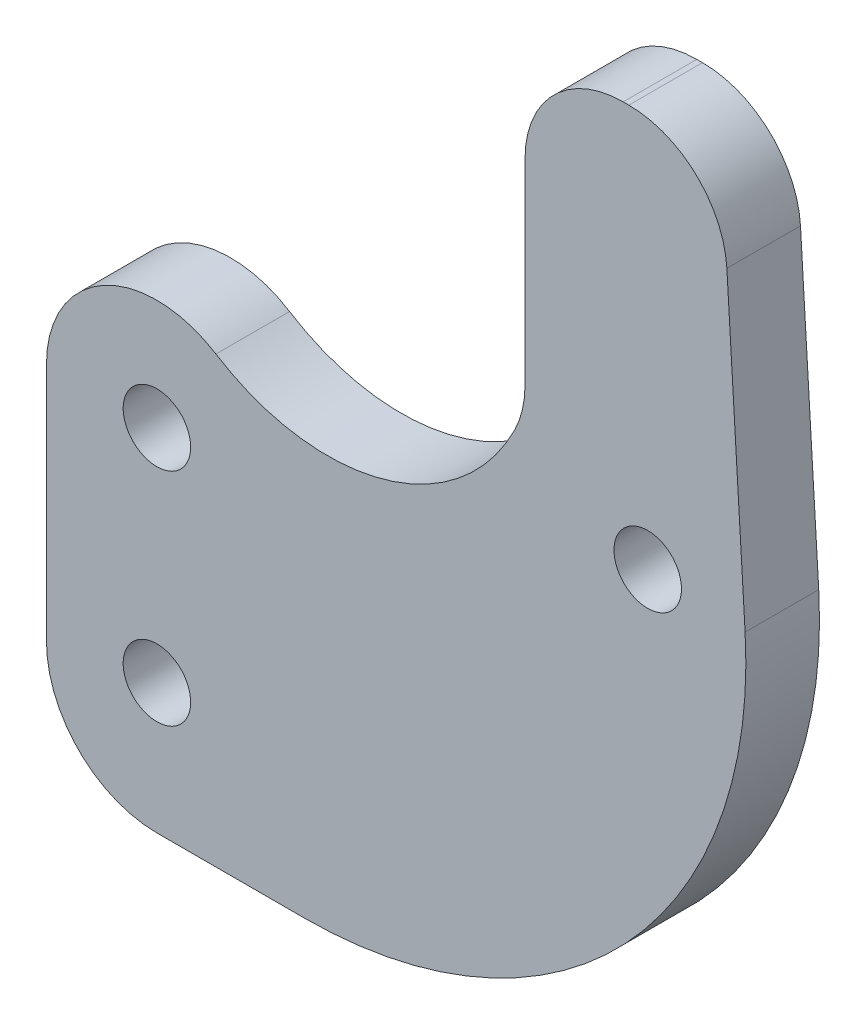
from build123d import *

# Parameters (mm, degrees)
SKETCH1_R           = 1.375
BOSS_EXTRUDE1_DEPTH = 3
FILLET1_R           = 4


with BuildPart() as part:
    # Sketch1 → Boss-Extrude1 (new body)
    with BuildSketch(Plane.XY):
        with BuildLine():
            Line((-4.5, -0.8), (-4.5, 9))
            ThreePointArc((-4.5, 9), (-2.171359962, 12.941471288), (2.404531518, 12.803712421))
            ThreePointArc((2.404531518, 12.803712421), (9.257380419, 11.803998346), (14.585878733, 16.227579703))
            ThreePointArc((14.585878733, 16.227579703), (14.895094025, 17.089921688), (15, 18))
            Line((15, 18), (15, 30))
            Line((15, 30), (23, 30))
            Line((23, 30), (23.968058833, 13.771849702))
            ThreePointArc((23.968058833, 13.771849702), (19.101398678, 0.356849969), (6, -5.3))
            Line((6, -5.3), (0, -5.3))
            ThreePointArc((0, -5.3), (-3.181980515, -3.981980515), (-4.5, -0.8))
        make_face()
        Circle(SKETCH1_R, mode=Mode.SUBTRACT)
        with Locations((0, 9)):
            Circle(SKETCH1_R, mode=Mode.SUBTRACT)
        with Locations((20, 14)):
            Circle(SKETCH1_R, mode=Mode.SUBTRACT)
    extrude(amount=BOSS_EXTRUDE1_DEPTH)

    # Fillet1
    fillet1_edges = [part.edges().sort_by_distance(p)[0] for p in [
        (15, 30, 1.5),
        (23, 30, 1.5),
    ]]
    fillet(fillet1_edges, radius=FILLET1_R)


solid = part.part
